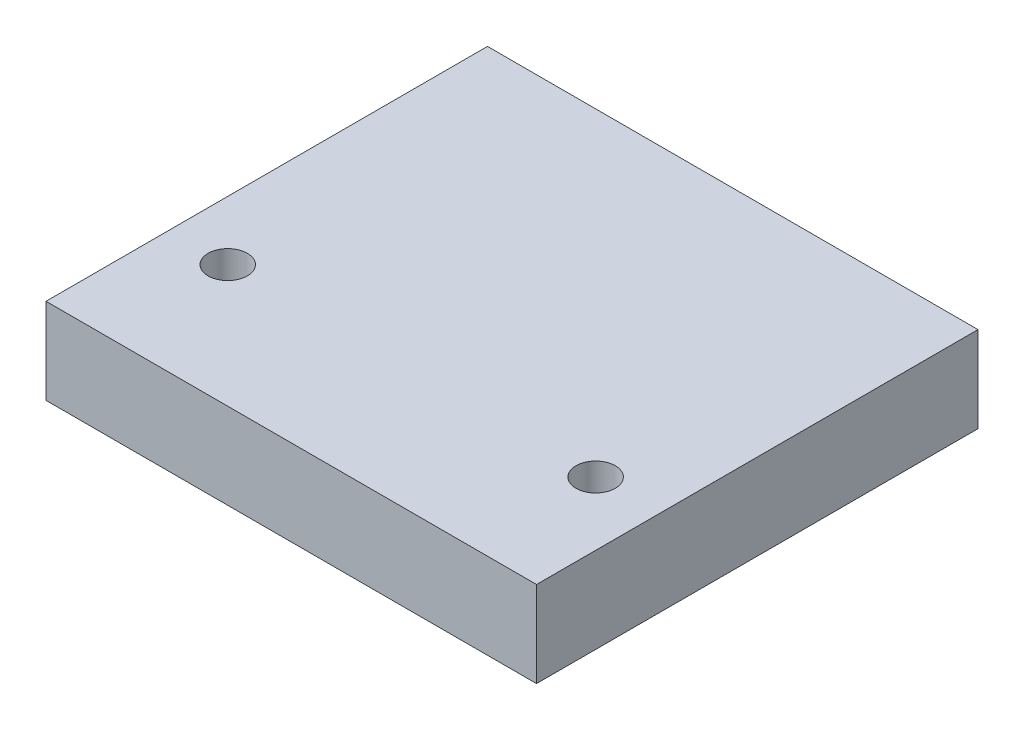
from build123d import *

# Parameters (mm, degrees)
SKETCH_1_W               = 20
SKETCH_1_H               = 3.5
EXTRUDE_1_DEPTH          = 18
SKETCH_2_R               = 0.8
CUT_EXTRUDE_1_DEPTH      = 23.497727458
HOLE_WIZARD_M1_6_1_D     = 1.25
HOLE_WIZARD_M1_6_1_DEPTH = 4
HOLE_WIZARD_M1_6_1_TIP   = 0.375537887


with BuildPart() as part:
    # 草图1 → 凸台-拉伸1 (new body)
    with BuildSketch(Plane.XY):
        with Locations((3.034482759, -1.420060756)):
            Rectangle(SKETCH_1_W, SKETCH_1_H)
    extrude(amount=EXTRUDE_1_DEPTH)

    # 草图2 → 切除-拉伸1 (cut, through all)
    with BuildSketch(Plane(origin=(0, 0.329939244, 0), x_dir=(1, 0, 0), z_dir=(0, 1, 0))):
        with Locations(Location((-4.555517241, -13, 0), (0, 0, 270))):
            Circle(SKETCH_2_R)
        with Locations(Location((10.444482759, -13, 0), (0, 0, 270))):
            Circle(SKETCH_2_R)
    extrude(amount=-CUT_EXTRUDE_1_DEPTH, mode=Mode.SUBTRACT)

    # M1.6 螺纹孔1
    with Locations(Plane.ZY.offset(6.965517241)):
        with Locations((2, -1.420060756), (8, -1.420060756)):
            Hole(HOLE_WIZARD_M1_6_1_D / 2, depth=HOLE_WIZARD_M1_6_1_DEPTH)
            with Locations((0, 0, -(HOLE_WIZARD_M1_6_1_DEPTH + HOLE_WIZARD_M1_6_1_TIP / 2))):  # 118° drill point
                Cone(0, HOLE_WIZARD_M1_6_1_D / 2, HOLE_WIZARD_M1_6_1_TIP, mode=Mode.SUBTRACT)


solid = part.part
